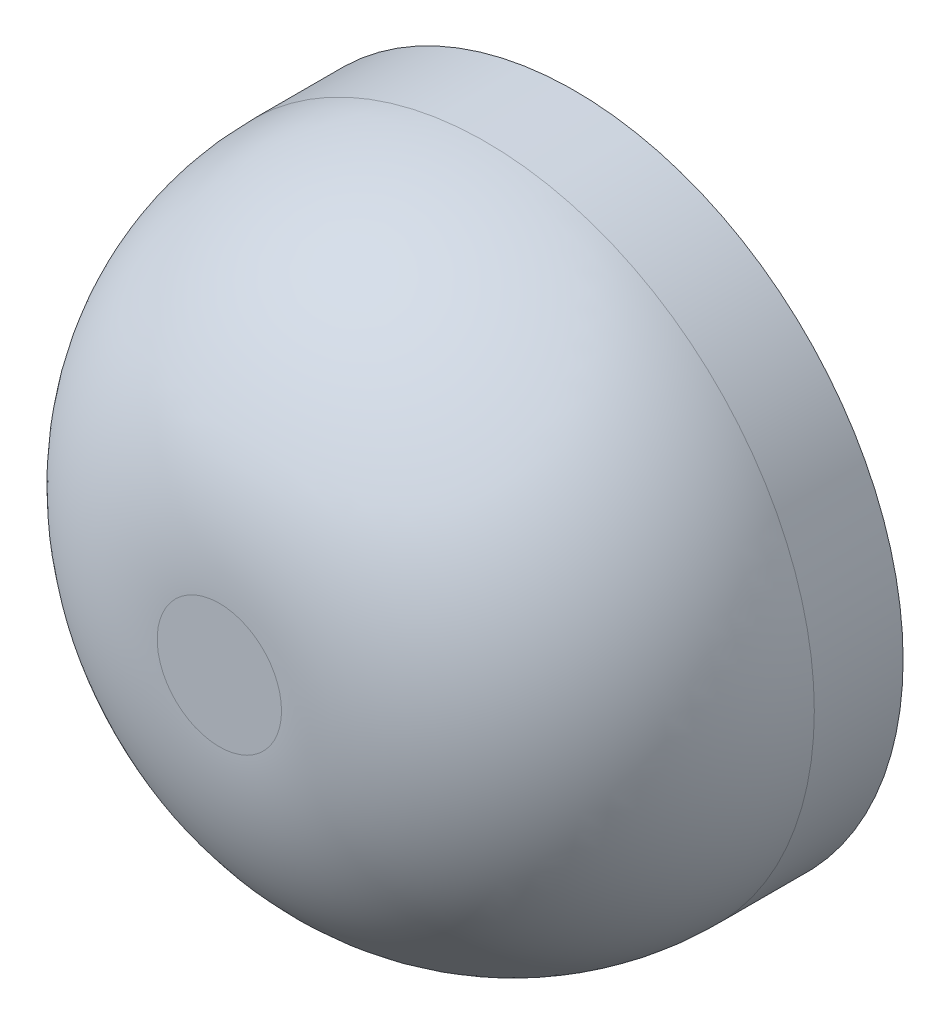
from build123d import *

# Parameters (mm, degrees)
SKETCH1_R           = 18.5
BOSS_EXTRUDE1_DEPTH = 20
FILLET1_R           = 15
SHELL1_T            = -2


with BuildPart() as part:
    # Sketch1 → Boss-Extrude1 (new body)
    with BuildSketch(Plane.XY):
        Circle(SKETCH1_R)
    extrude(amount=BOSS_EXTRUDE1_DEPTH)

    # Fillet1
    fillet1_edges = [part.edges().sort_by_distance(p)[0] for p in [
        (-18.5, 0, 20),
    ]]
    fillet(fillet1_edges, radius=FILLET1_R)

    # Shell1
    shell1_openings = [part.faces().sort_by_distance(p)[0] for p in [
        (0, 0, 0),
    ]]
    offset(amount=SHELL1_T, openings=shell1_openings, kind=Kind.INTERSECTION)


solid = part.part
